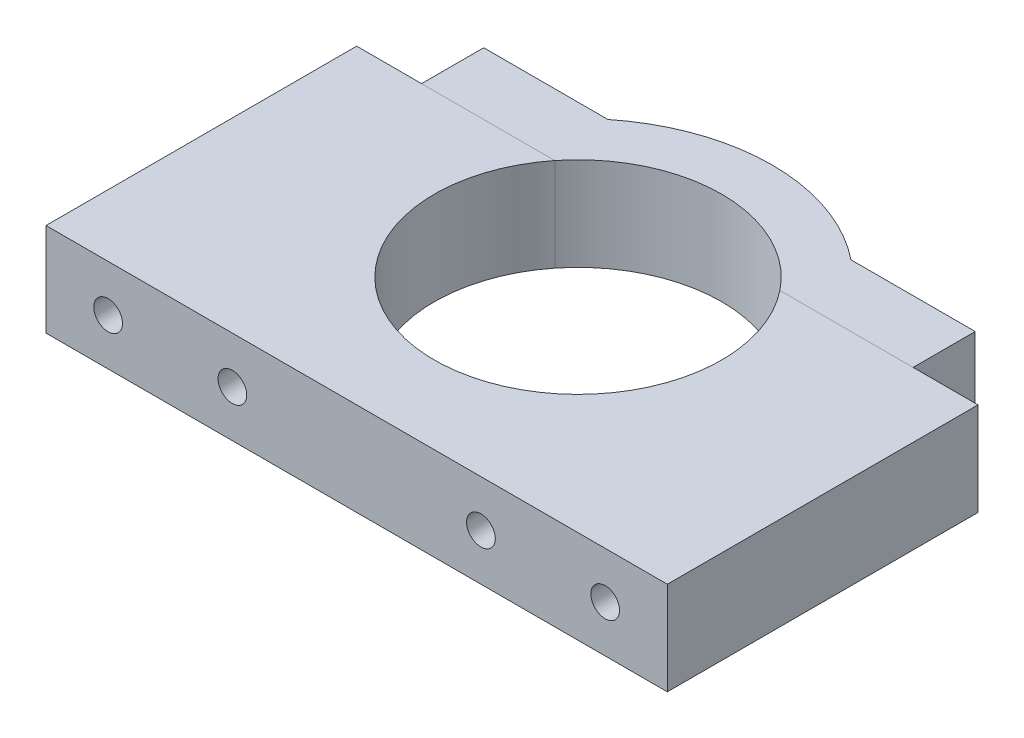
from build123d import *

# Parameters (mm, degrees)
MOTOR_MOUNT_DEPTH          = 6
TAPPING_COVER_DEPTH        = 6
SKETCH_2_R                 = 1.85
TAPPING_HOLES_BOTTOM_DEPTH = 8


with BuildPart() as part:
    # 草图1 → motor Mount (new, symmetric)
    with BuildSketch(Plane(origin=(0, 0, 0), x_dir=(1, 0, 0), z_dir=(0, 1, 0))):
        with BuildLine():
            Line((-40, 11.5), (-40, -28.5))
            Line((-40, -28.5), (40, -28.5))
            Line((40, -28.5), (40, 11.5))
            Line((40, 11.5), (31.644487847, 11.5))
            Line((31.644487847, 11.5), (14.491376746, 11.5))
            ThreePointArc((14.491376746, 11.5), (17.469122328, 6.089315651), (18.5, 0))
            ThreePointArc((18.5, 0), (-6.089315651, -17.469122328), (-14.491376746, 11.5))
            Line((-14.491376746, 11.5), (-31.644487847, 11.5))
            Line((-31.644487847, 11.5), (-40, 11.5))
        make_face()
    extrude(amount=MOTOR_MOUNT_DEPTH, both=True)

    # 草图2 → tapping holes_bottom (cut)
    with BuildSketch(Plane.XY.offset(28.5)):
        with Locations((32, 0)):
            Circle(SKETCH_2_R)
        with Locations((16, 0)):
            Circle(SKETCH_2_R)
        with Locations((-16, 0)):
            Circle(SKETCH_2_R)
        with Locations((-32, 0)):
            Circle(SKETCH_2_R)
    extrude(amount=-TAPPING_HOLES_BOTTOM_DEPTH, mode=Mode.SUBTRACT)


with BuildPart() as body_2:
    # 草图1<4> → tapping cover (new, symmetric)
    with BuildSketch(Plane(origin=(0, 0, 0), x_dir=(1, 0, 0), z_dir=(0, 1, 0))):
        with BuildLine():
            Line((-31.644487847, 19.5), (-31.644487847, 11.5))
            Line((-31.644487847, 11.5), (-14.491376746, 11.5))
            ThreePointArc((-14.491376746, 11.5), (0, 18.5), (14.491376746, 11.5))
            Line((14.491376746, 11.5), (31.644487847, 11.5))
            Line((31.644487847, 11.5), (31.644487847, 19.5))
            Line((31.644487847, 19.5), (15.644487847, 19.5))
            ThreePointArc((15.644487847, 19.5), (0, 25), (-15.644487847, 19.5))
            Line((-15.644487847, 19.5), (-31.644487847, 19.5))
        make_face()
    extrude(amount=TAPPING_COVER_DEPTH, both=True)


solid = Compound([part.part, body_2.part])
